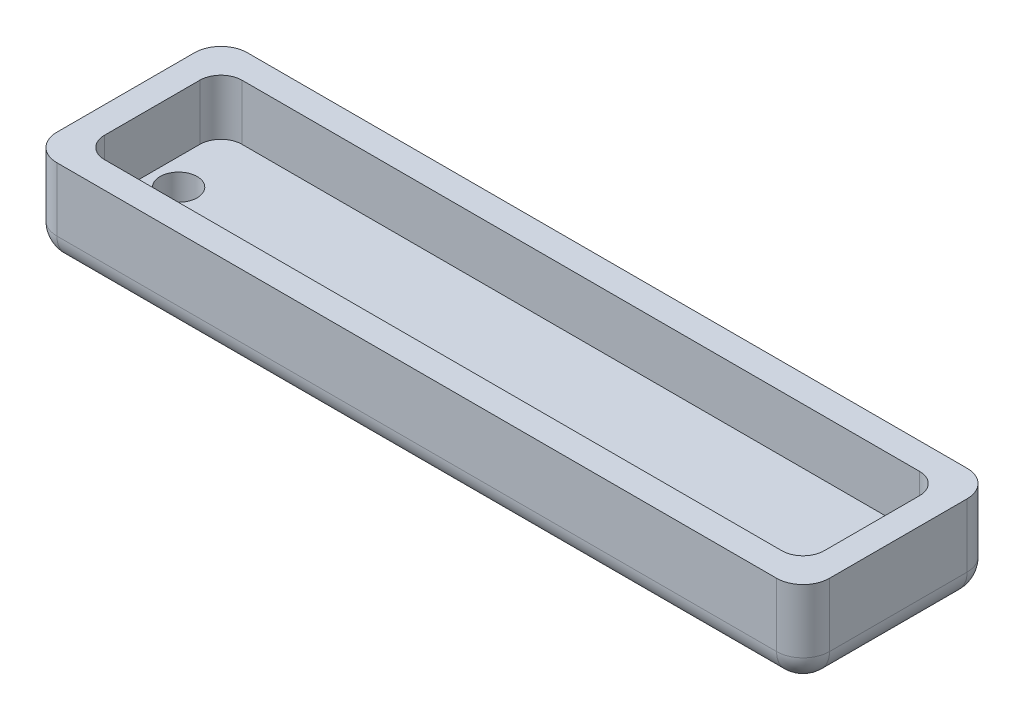
from build123d import *

# Parameters (mm, degrees)
SKETCH1_W           = 37.084
SKETCH1_H           = 9.144
BOSS_EXTRUDE1_DEPTH = 4.318
SKETCH2_W           = 34.544
SKETCH2_H           = 6.604
CUT_EXTRUDE3_DEPTH  = 2.667
FILLET1_R           = 1.27
FILLET2_R           = 1.016
SKETCH11_R          = 0.889
CUT_EXTRUDE4_DEPTH  = 20.282682308


with BuildPart() as part:
    # Sketch1 → Boss-Extrude1 (new body)
    with BuildSketch(Plane(origin=(0, 0, 0), x_dir=(1, 0, 0), z_dir=(0, 1, 0))):
        Rectangle(SKETCH1_W, SKETCH1_H)
    extrude(amount=BOSS_EXTRUDE1_DEPTH)

    # Sketch2 → Cut-Extrude3 (cut)
    with BuildSketch(Plane(origin=(0, 4.318, 0), x_dir=(1, 0, 0), z_dir=(0, 1, 0))):
        Rectangle(SKETCH2_W, SKETCH2_H)
    extrude(amount=-CUT_EXTRUDE3_DEPTH, mode=Mode.SUBTRACT)

    # Fillet1
    fillet1_edges = [part.edges().sort_by_distance(p)[0] for p in [
        (0, 0, 4.572),
        (-18.542, 0, 0),
        (0, 0, -4.572),
        (18.542, 0, 0),
        (18.542, 2.159, 4.572),
        (-18.542, 2.159, 4.572),
        (-18.542, 2.159, -4.572),
        (18.542, 2.159, -4.572),
    ]]
    fillet(fillet1_edges, radius=FILLET1_R)

    # Fillet2
    fillet2_edges = [part.edges().sort_by_distance(p)[0] for p in [
        (-17.272, 2.9845, -3.302),
        (-17.272, 2.9845, 3.302),
        (17.272, 2.9845, 3.302),
        (17.272, 2.9845, -3.302),
    ]]
    fillet(fillet2_edges, radius=FILLET2_R)

    # Sketch11 → Cut-Extrude4 (cut, through all)
    with BuildSketch(Plane(origin=(0, 1.651, 0), x_dir=(1, 0, 0), z_dir=(0, 1, 0))):
        with Locations(Location((-16.002, 0, 0), (0, 0, 270))):
            Circle(SKETCH11_R)
        with Locations(Location((16.002, 0, 0), (0, 0, 270))):
            Circle(SKETCH11_R)
    extrude(amount=-CUT_EXTRUDE4_DEPTH, mode=Mode.SUBTRACT)


solid = part.part
